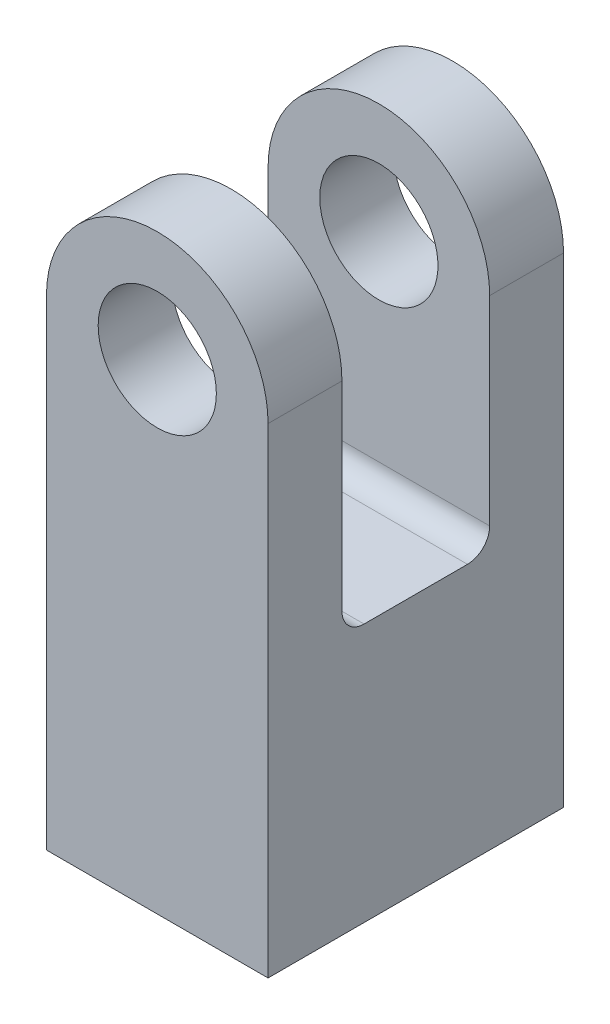
from build123d import *

# Parameters (mm, degrees)
SKETCH_1_R          = 8
EXTRUDE_1_DEPTH     = 40
CUT_EXTRUDE_START   = 20
SKETCH_2_W          = 30
SKETCH_2_H          = 45
CUT_EXTRUDE_1_DEPTH = 10
FILLET_1_R          = 3


with BuildPart() as part:
    # Эскиз1 → Бобышка-Вытянуть1 (new body)
    with BuildSketch(Plane.XY):
        with BuildLine():
            Line((0, 0), (30, 0))
            Line((30, 0), (30, 65))
            ThreePointArc((30, 65), (15, 80), (0, 65))
            Line((0, 65), (0, 0))
        make_face()
        with Locations((15, 65)):
            Circle(SKETCH_1_R, mode=Mode.SUBTRACT)
    extrude(amount=EXTRUDE_1_DEPTH)

    # Эскиз2 → Вырез-Вытянуть1 (cut, symmetric)
    with BuildSketch(Plane.XY.offset(CUT_EXTRUDE_START)):
        with Locations((15, 57.5)):
            Rectangle(SKETCH_2_W, SKETCH_2_H)
    extrude(amount=CUT_EXTRUDE_1_DEPTH, both=True, mode=Mode.SUBTRACT)

    # Скругление1
    fillet_1_edges = [part.edges().sort_by_distance(p)[0] for p in [
        (15, 35, 30),
        (15, 35, 10),
    ]]
    fillet(fillet_1_edges, radius=FILLET_1_R)


solid = part.part
